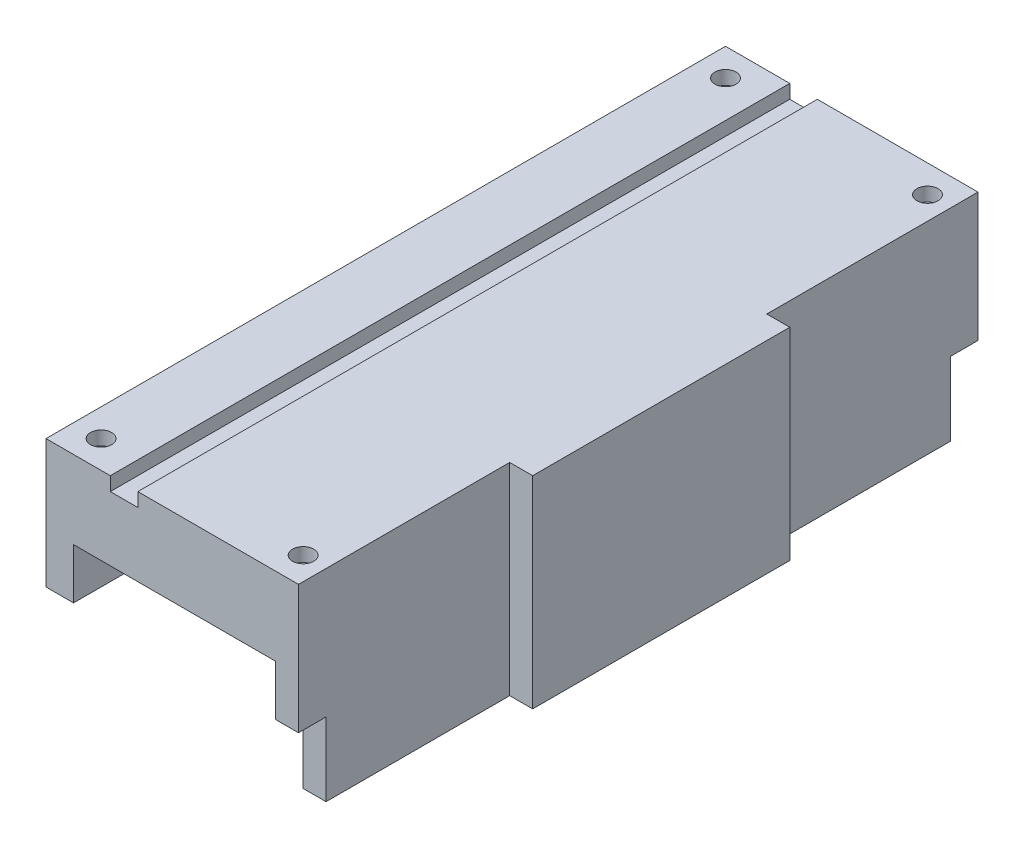
from build123d import *

# Parameters (mm, degrees)
BOSS_EXTRUDE1_DEPTH = 22
SKETCH2_W           = 68
SKETCH2_H           = 3
BOSS_EXTRUDE2_DEPTH = 22
BOSS_EXTRUDE3_DEPTH = 14
CUT_EXTRUDE1_DEPTH  = 10
SKETCH5_R           = 1.15
SKETCH5_W           = 3
SKETCH5_H           = 74
CUT_EXTRUDE2_DEPTH  = 1.5


with BuildPart() as part:
    # Sketch1 → Boss-Extrude1 (new body)
    with BuildSketch(Plane(origin=(0, 0, 0), x_dir=(1, 0, 0), z_dir=(0, 1, 0))):
        Polygon((14, 14), (11.5, 14), (11.5, 34), (9, 34), (9, -34), (11.5, -34), (11.5, -14), (14, -14), align=None)
    extrude(amount=BOSS_EXTRUDE1_DEPTH)

    # Sketch2 → Boss-Extrude2 (add)
    with BuildSketch(Plane.ZY.offset(-9)):
        with Locations((0, 20.5)):
            Rectangle(SKETCH2_W, SKETCH2_H)
    extrude(amount=BOSS_EXTRUDE2_DEPTH)

    # Sketch3 → Boss-Extrude3 (add)
    with BuildSketch(Plane(origin=(0, 22, 0), x_dir=(1, 0, 0), z_dir=(0, 1, 0))):
        Polygon((-13, 34), (11.5, 34), (11.5, 37), (-16, 37), (-16, -37), (11.5, -37), (11.5, -34), (-13, -34), align=None)
    extrude(amount=-BOSS_EXTRUDE3_DEPTH)

    # Sketch4 → Cut-Extrude1 (cut)
    with BuildSketch(Plane.XY.offset(37)):
        Polygon((7, 13.5), (-11, 13.5), (-13, 13.5), (-13, 8), (-11, 8), (7, 8), (9, 8), (9, 13.5), align=None)
    extrude(amount=-CUT_EXTRUDE1_DEPTH, mode=Mode.SUBTRACT)

    # Sketch5 → Cut-Extrude2 (cut)
    with BuildSketch(Plane(origin=(0, 22, 0), x_dir=(1, 0, 0), z_dir=(0, 1, 0))):
        with Locations(Location((9, 34, 0), (0, 0, 270))):
            Circle(SKETCH5_R)
        with Locations(Location((9, -34, 0), (0, 0, 270))):
            Circle(SKETCH5_R)
        with Locations(Location((-13, -34, 0), (0, 0, 270))):
            Circle(SKETCH5_R)
        with Locations(Location((-13, 34, 0), (0, 0, 270))):
            Circle(SKETCH5_R)
        with Locations((-7.5, 0)):
            Rectangle(SKETCH5_W, SKETCH5_H)
    extrude(amount=-CUT_EXTRUDE2_DEPTH, mode=Mode.SUBTRACT)


solid = part.part
